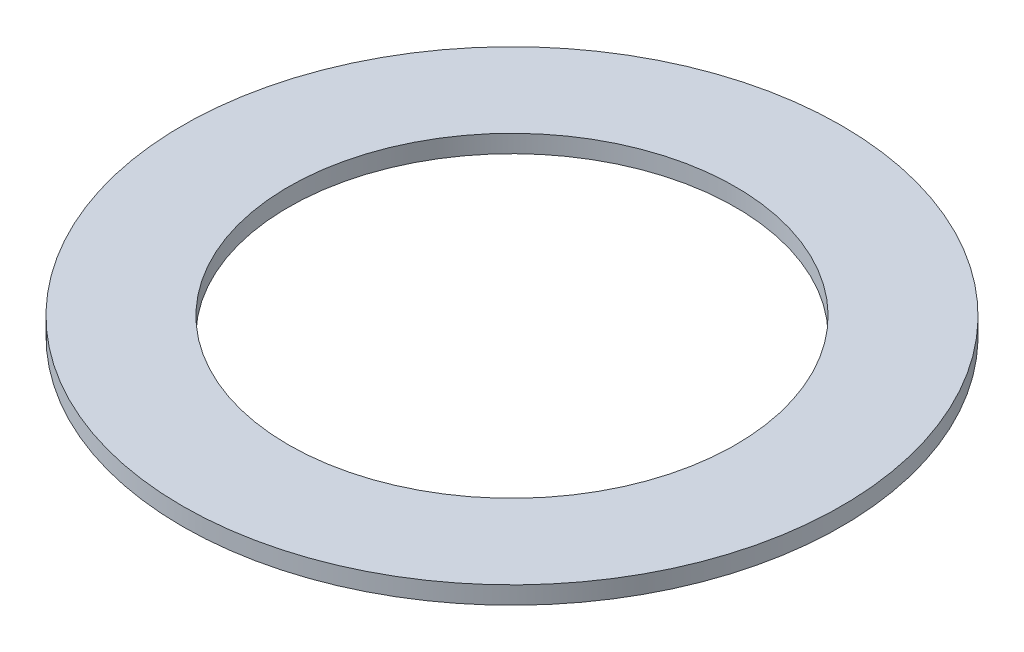
from build123d import *

# Parameters (mm, degrees)
SKETCH1_R           = 4.7371
SKETCH1_R_2         = 3.2131
BOSS_EXTRUDE1_DEPTH = 0.127


with BuildPart() as part:
    # Sketch1 → Boss-Extrude1 (new, symmetric)
    with BuildSketch(Plane(origin=(0, 0, 0), x_dir=(1, 0, 0), z_dir=(0, 1, 0))):
        with Locations(Location((0, 0, 0), (0, 0, 270))):
            Circle(SKETCH1_R)
        with Locations(Location((0, 0, 0), (0, 0, 270))):
            Circle(SKETCH1_R_2, mode=Mode.SUBTRACT)
    extrude(amount=BOSS_EXTRUDE1_DEPTH, both=True)


solid = part.part
